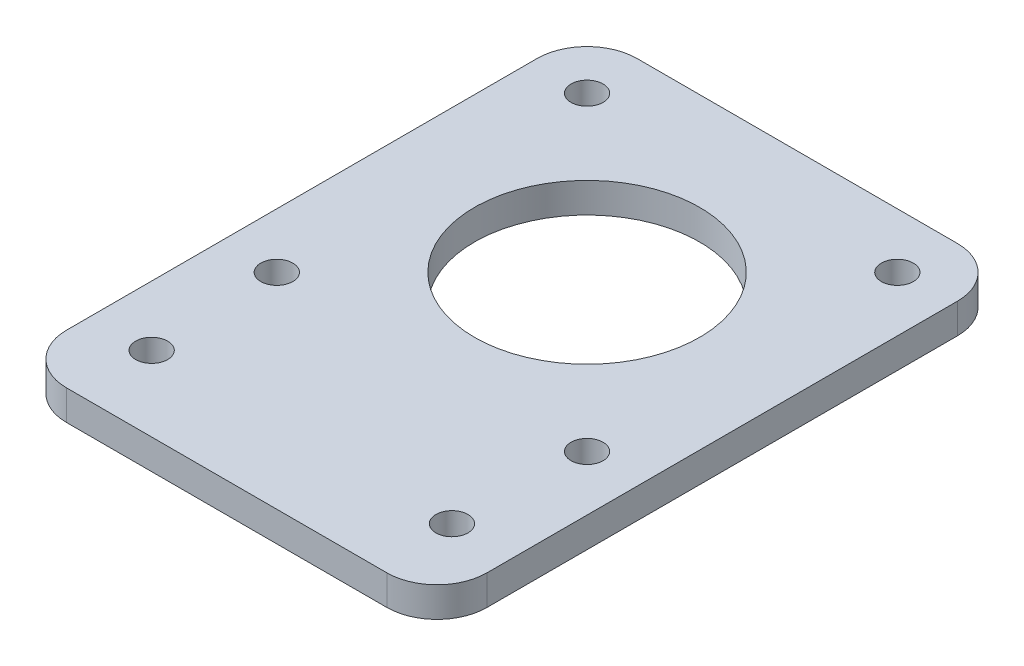
from build123d import *

# Parameters (mm, degrees)
SKETCH1_W           = 42
SKETCH1_H           = 57
SKETCH1_R           = 1.6
SKETCH1_R_2         = 11.25
BOSS_EXTRUDE1_DEPTH = 3
FILLET1_R           = 5


with BuildPart() as part:
    # Sketch1 → Boss-Extrude1 (new body)
    with BuildSketch(Plane(origin=(0, 0, 0), x_dir=(1, 0, 0), z_dir=(0, 1, 0))):
        with Locations((21, 28.5)):
            Rectangle(SKETCH1_W, SKETCH1_H)
        with Locations(Location((36.5, 51.5, 0), (0, 0, 270))):
            Circle(SKETCH1_R, mode=Mode.SUBTRACT)
        with Locations(Location((5.5, 51.5, 0), (0, 0, 270))):
            Circle(SKETCH1_R, mode=Mode.SUBTRACT)
        with Locations(Location((5.5, 20.5, 0), (0, 0, 270))):
            Circle(SKETCH1_R, mode=Mode.SUBTRACT)
        with Locations(Location((36.5, 20.5, 0), (0, 0, 270))):
            Circle(SKETCH1_R, mode=Mode.SUBTRACT)
        with Locations(Location((6, 7.5, 0), (0, 0, 270))):
            Circle(SKETCH1_R, mode=Mode.SUBTRACT)
        with Locations(Location((36, 7.5, 0), (0, 0, 270))):
            Circle(SKETCH1_R, mode=Mode.SUBTRACT)
        with Locations(Location((21, 36, 0), (0, 0, 270))):
            Circle(SKETCH1_R_2, mode=Mode.SUBTRACT)
    extrude(amount=BOSS_EXTRUDE1_DEPTH)

    # Fillet1
    fillet1_edges = [part.edges().sort_by_distance(p)[0] for p in [
        (0, 1.5, -57),
        (42, 1.5, -57),
        (42, 1.5, 0),
        (0, 1.5, 0),
    ]]
    fillet(fillet1_edges, radius=FILLET1_R)


solid = part.part
